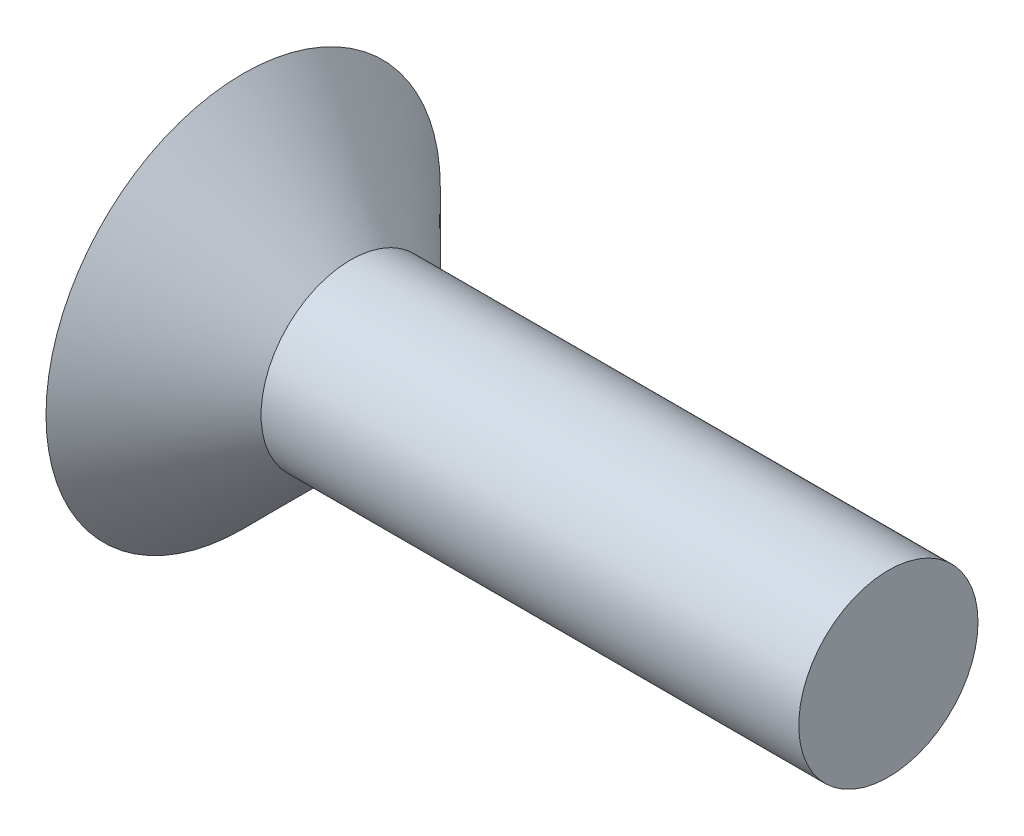
from build123d import *


with BuildPart() as part:
    # Эскиз1 → Повернуть1 (revolve)
    with BuildSketch(Plane.XY, mode=Mode.PRIVATE) as revolve_1_sk:
        Polygon((0, 0), (0, 2.2), (1.2, 1), (7.2, 1), (7.2, 0), align=None)
    revolve(revolve_1_sk.sketch.rotate(Axis((0, 0, 0), (-1, 0, 0)), 90), axis=Axis((0, 0, 0), (-1, 0, 0)))


solid = part.part
